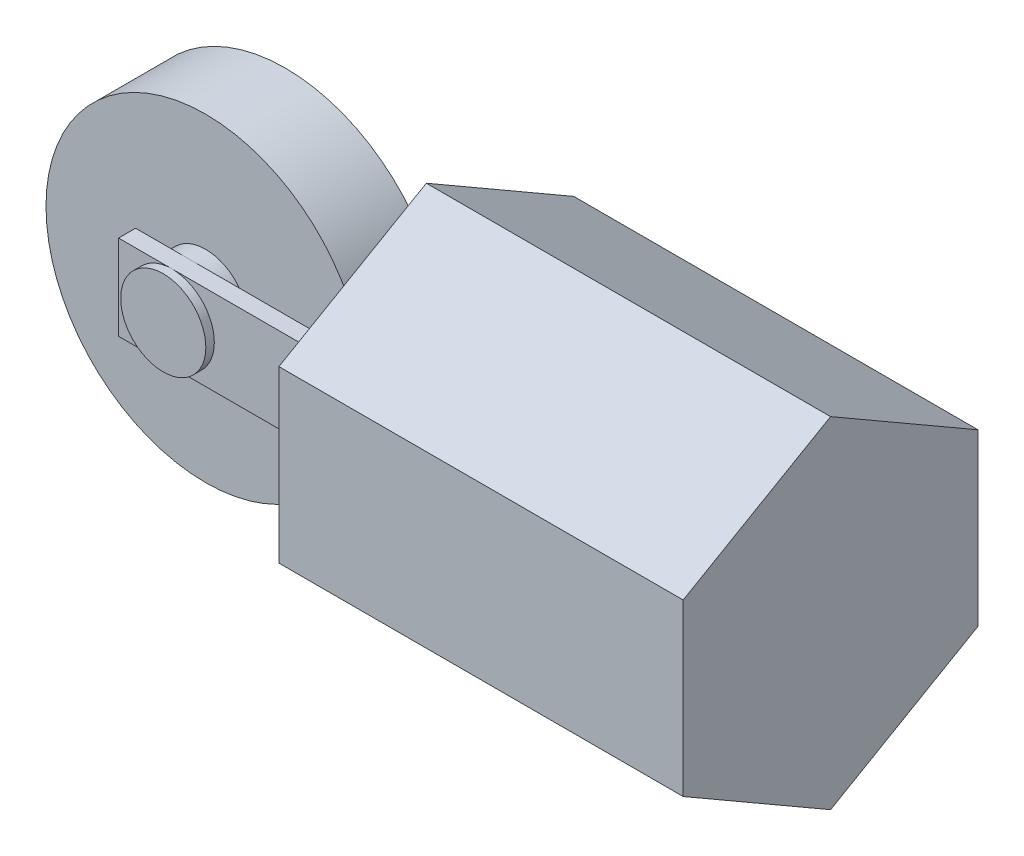
from build123d import *

# Parameters (mm, degrees)
SKETCH3_R                = 9.525
BOSS_EXTRUDE1_DEPTH      = 2.38125
BOSS_EXTRUDE4_DEPTH      = 25.4
SKETCH7_W                = 5.08
SKETCH7_H                = 1.016
BOSS_EXTRUDE5_DEPTH      = 12.7
CUT_EXTRUDE1_DEPTH       = 1.27
BOSS_EXTRUDE6_DEPTH      = 0.508
BOSS_EXTRUDE6_DEPTH_BACK = 9.398
SKETCH11_R               = 2.54
BOSS_EXTRUDE7_DEPTH      = 24.13


with BuildPart() as part:
    # Sketch3 → Boss-Extrude1 (new, symmetric)
    with BuildSketch(Plane(origin=(0, 0, 0), x_dir=(0, 1, 0), z_dir=(0, 0, 1))):
        with Locations(Location((0, 0, 0), (0, 0, 90))):
            Circle(SKETCH3_R)
    extrude(amount=BOSS_EXTRUDE1_DEPTH, both=True)



with BuildPart() as body_2:
    # Sketch6 → Boss-Extrude4 (new body)
    with BuildSketch(Plane.YZ.offset(9.525)):
        Polygon((-5.08, 0), (-2.54, -4.399409051), (2.54, -4.399409051), (5.08, 0), (2.54, 4.399409051), (-2.54, 4.399409051), align=None)
    extrude(amount=BOSS_EXTRUDE4_DEPTH)

    # Sketch7 → Boss-Extrude5 (add)
    with BuildSketch(Plane(origin=(9.525, 0, 0), x_dir=(0, -1, 0), z_dir=(-1, 0, 0))):
        with Locations((0, 3.891409051)):
            Rectangle(SKETCH7_W, SKETCH7_H)
        with Locations((0, -3.891409051)):
            Rectangle(SKETCH7_W, SKETCH7_H)
    extrude(amount=BOSS_EXTRUDE5_DEPTH)

    # Sketch10 → Cut-Extrude1 (cut)
    with BuildSketch(Plane(origin=(9.525, 0, 0), x_dir=(0, -1, 0), z_dir=(-1, 0, 0))):
        Polygon((-2.54, 4.399409051), (-5.08, 0), (-2.54, -4.399409051), (-2.54, -3.383409051), (2.54, -3.383409051), (2.54, -4.399409051), (5.08, 0), (2.54, 4.399409051), (2.54, 3.383409051), (-2.54, 3.383409051), align=None)
    extrude(amount=-CUT_EXTRUDE1_DEPTH, mode=Mode.SUBTRACT)


with BuildPart() as part_1:
    add(part.part)

    add(body_2.part)  # Boss-Extrude6 merges body 2
    # Sketch11 → Boss-Extrude6 (add, two sides: drawn at the far end of the back side and taken through both)
    with BuildSketch(Plane.XY.offset(4.399409051).offset(-BOSS_EXTRUDE6_DEPTH_BACK)):
        Circle(SKETCH11_R)
    extrude(amount=BOSS_EXTRUDE6_DEPTH + BOSS_EXTRUDE6_DEPTH_BACK)

    # Sketch12 → Boss-Extrude7 (add)
    with BuildSketch(Plane.YZ.offset(34.925)):
        Polygon((-10.16, 0), (-5.08, -8.798818102), (5.08, -8.798818102), (10.16, 0), (5.08, 8.798818102), (-5.08, 8.798818102), align=None)
    extrude(amount=-BOSS_EXTRUDE7_DEPTH)


solid = part_1.part
